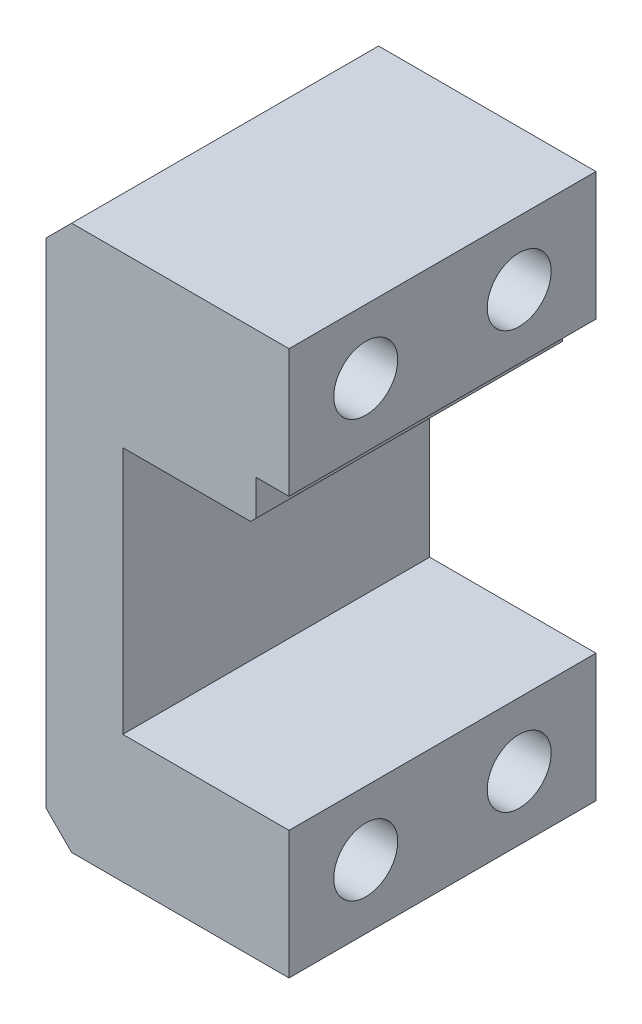
from build123d import *

# Parameters (mm, degrees)
EXTRUDE_1_DEPTH    = 12
CHAMFER_1_SIZE     = 0.2
HOLE_WIZARD_M3_2_D = 2.5
CHAMFER_2_SIZE     = 1


with BuildPart() as part:
    # 草图1 → 凸台-拉伸1 (new body)
    with BuildSketch(Plane.XY):
        Polygon((0, 0), (0, 21.31), (9.5, 21.31), (9.5, 16.31), (8.2, 16.31), (8.2, 14.71), (3, 14.71), (3, 5), (9.5, 5), (9.5, 0), align=None)
    extrude(amount=EXTRUDE_1_DEPTH)

    # 倒角1
    chamfer_1_edges = [part.edges().sort_by_distance(p)[0] for p in [
        (8.2, 14.71, 6),
    ]]
    chamfer(chamfer_1_edges, length=CHAMFER_1_SIZE)

    # M3 螺纹孔2 (through all)
    with Locations(Plane(origin=(0, 2.5, 3), x_dir=(0, 0, -1), z_dir=(-1, 0, 0))):
        with Locations((0, 0), (-6, 0), (-6, -16.31), (0, -16.31)):
            Hole(HOLE_WIZARD_M3_2_D / 2)

    # 倒角2
    chamfer_2_edges = [part.edges().sort_by_distance(p)[0] for p in [
        (0, 0, 6),
        (0, 21.31, 6),
    ]]
    chamfer(chamfer_2_edges, length=CHAMFER_2_SIZE)


solid = part.part
